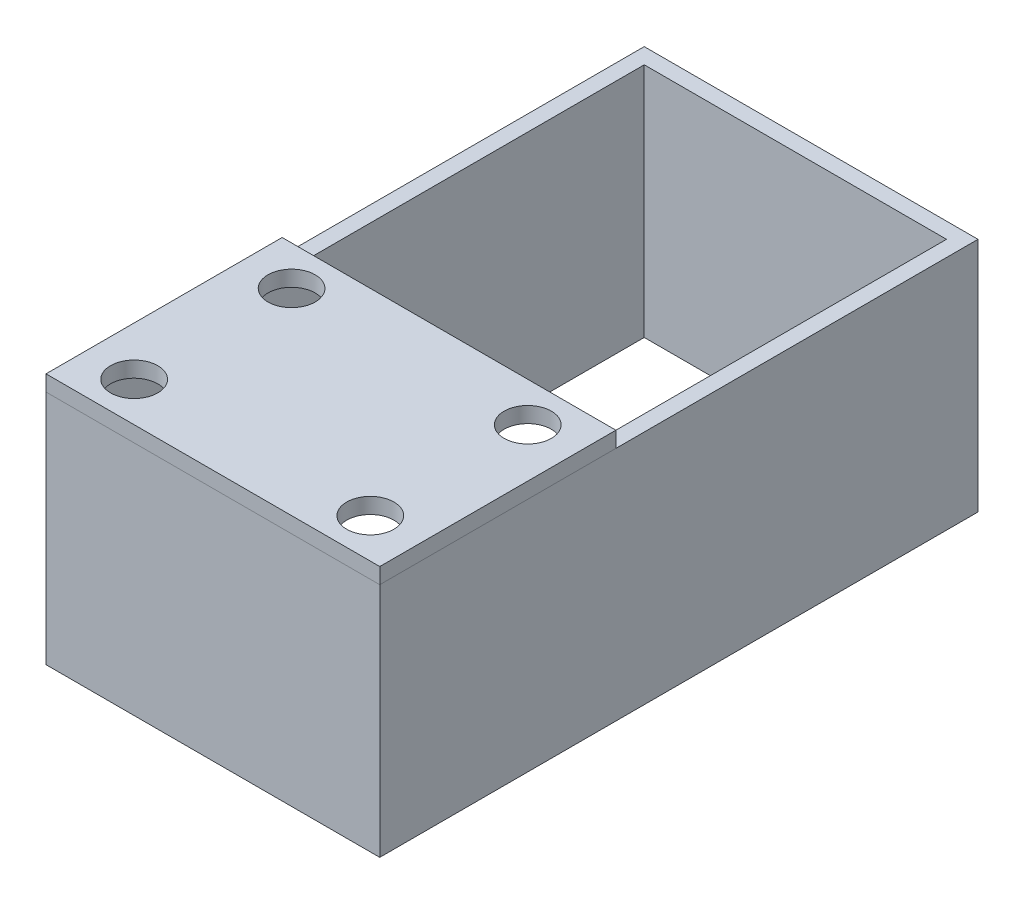
from build123d import *

# Parameters (mm, degrees)
SKETCH2_W           = 42.4
SKETCH2_H           = 76
SKETCH2_W_2         = 38.4
SKETCH2_H_2         = 72
BOSS_EXTRUDE4_DEPTH = 30
SKETCH1_W           = 42.4
SKETCH1_H           = 30
SKETCH1_R           = 3
BOSS_EXTRUDE1_DEPTH = 2


with BuildPart() as part:
    # Sketch2 → Boss-Extrude4 (new body)
    with BuildSketch(Plane(origin=(0, 0, 0), x_dir=(1, 0, 0), z_dir=(0, 1, 0))):
        with Locations((19.2, 36)):
            Rectangle(SKETCH2_W, SKETCH2_H)
        with Locations((19.2, 36)):
            Rectangle(SKETCH2_W_2, SKETCH2_H_2, mode=Mode.SUBTRACT)
    extrude(amount=BOSS_EXTRUDE4_DEPTH)


with BuildPart() as body_2:
    # Sketch1 → Boss-Extrude1 (new body)
    with BuildSketch(Plane(origin=(0, 30, 0), x_dir=(1, 0, 0), z_dir=(0, 1, 0))):
        with Locations((19.2, 13)):
            Rectangle(SKETCH1_W, SKETCH1_H)
        with Locations(Location((4.2, 3, 0), (0, 0, 270))):
            Circle(SKETCH1_R, mode=Mode.SUBTRACT)
        with Locations(Location((34.2, 3, 0), (0, 0, 90))):
            Circle(SKETCH1_R, mode=Mode.SUBTRACT)
        with Locations(Location((34.2, 23, 0), (0, 0, 270))):
            Circle(SKETCH1_R, mode=Mode.SUBTRACT)
        with Locations(Location((4.2, 23, 0), (0, 0, 90))):
            Circle(SKETCH1_R, mode=Mode.SUBTRACT)
    extrude(amount=BOSS_EXTRUDE1_DEPTH)


solid = Compound([part.part, body_2.part])
